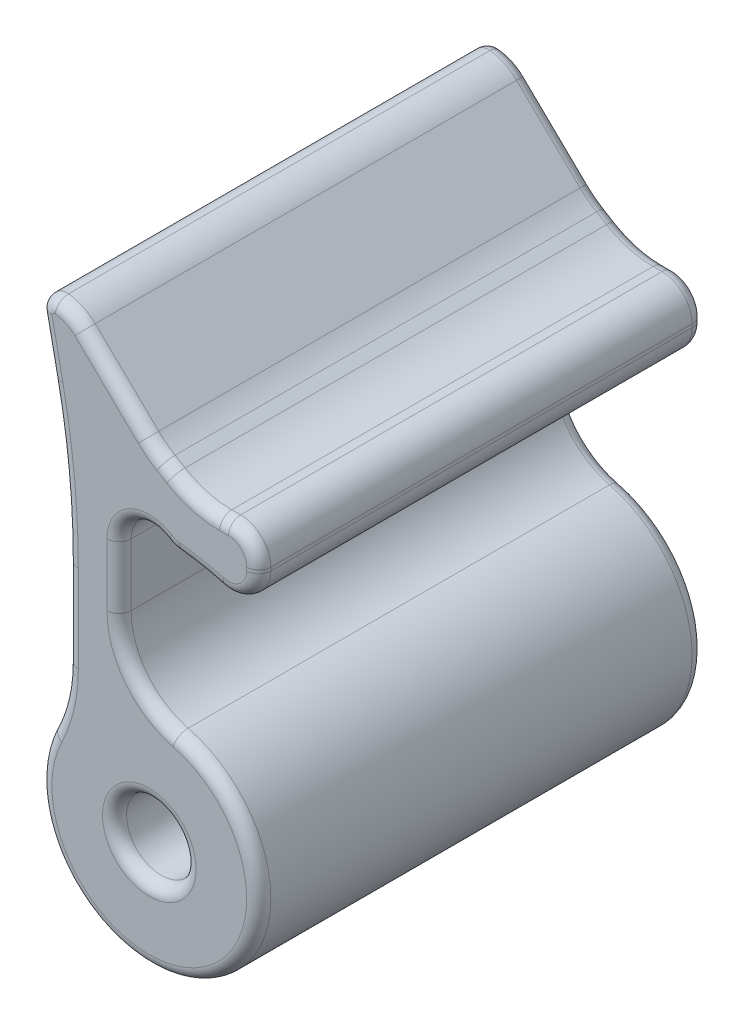
from build123d import *

# Parameters (mm, degrees)
SKETCH_1_R          = 2.3
EXTRUDE_1_DEPTH     = 29.5
CUT_EXTRUDE_2_DEPTH = 83.376773242
FILLET_4_R          = 3
FILLET_5_R          = 1
CUT_EXTRUDE_3_DEPTH = 83.368849205
CUT_EXTRUDE_4_DEPTH = 83.368849205
FILLET_6_R          = 2
FILLET_7_R          = 0.8


with BuildPart() as part:
    # 草图1 → 凸台-拉伸1 (new body)
    with BuildSketch(Plane.XY):
        with BuildLine():
            Line((49.84110478, 44.817097999), (48.055206395, 44.817097999))
            ThreePointArc((48.055206395, 44.817097999), (47.055206395, 45.085047192), (46.323155587, 45.817097999))
            ThreePointArc((46.323155587, 45.817097999), (44.073466689, 46.748949652), (42.59110478, 44.817097999))
            Line((42.59110478, 44.817097999), (42.59110478, 40.694071519))
            ThreePointArc((42.59110478, 40.694071519), (43.646332988, 37.621812495), (46.366614984, 35.846327225))
            ThreePointArc((46.366614984, 35.846327225), (49.045880364, 23.097178901), (37.34110478, 28.817097999))
            Line((37.34110478, 28.817097999), (37.34110478, 44.817097999))
            Line((37.34110478, 44.817097999), (37.34110478, 56.817097999))
            Line((37.34110478, 56.817097999), (42.59110478, 56.817097999))
            Line((42.59110478, 56.817097999), (42.59110478, 56.214240273))
            ThreePointArc((42.59110478, 56.214240273), (43.369905339, 53.258047383), (45.504130247, 51.069282719))
            Line((45.504130247, 51.069282719), (46.166034037, 50.672140445))
            ThreePointArc((46.166034037, 50.672140445), (47.651407078, 50.03480843), (49.253008569, 49.817097999))
            Line((49.253008569, 49.817097999), (49.84110478, 49.817097999))
            ThreePointArc((49.84110478, 49.817097999), (51.255318342, 49.231311562), (51.84110478, 47.817097999))
            Line((51.84110478, 47.817097999), (51.84110478, 46.817097999))
            ThreePointArc((51.84110478, 46.817097999), (51.255318342, 45.402884437), (49.84110478, 44.817097999))
        make_face()
        with Locations((44.59110478, 28.817097999)):
            Circle(SKETCH_1_R, mode=Mode.SUBTRACT)
    extrude(amount=EXTRUDE_1_DEPTH)

    # 草图3 → 切除-拉伸2 (cut, through all)
    with BuildSketch(Plane.XY.offset(29.5)):
        with BuildLine():
            Line((39.34110478, 56.817097999), (44.418230467, 51.902962044))
            ThreePointArc((44.418230467, 51.902962044), (43.066738487, 53.873006183), (42.59110478, 56.214240273))
            Line((42.59110478, 56.214240273), (42.59110478, 56.817097999))
            Line((42.59110478, 56.817097999), (39.34110478, 56.817097999))
        make_face()
    extrude(amount=-CUT_EXTRUDE_2_DEPTH, mode=Mode.SUBTRACT)

    # 圆角4
    fillet_4_edges = [part.edges().sort_by_distance(p)[0] for p in [
        (39.34110478, 56.817097999, 14.75),
    ]]
    fillet(fillet_4_edges, radius=FILLET_4_R)

    # 圆角5
    fillet_5_edges = [part.edges().sort_by_distance(p)[0] for p in [
        (37.34110478, 56.817097999, 14.75),
    ]]
    fillet(fillet_5_edges, radius=FILLET_5_R)

    # 草图4 → 切除-拉伸3 (cut, through all)
    with BuildSketch(Plane.XY.offset(29.5)):
        with BuildLine():
            Line((48.055206395, 44.817097999), (49.84110478, 44.817097999))
            ThreePointArc((49.84110478, 44.817097999), (50.40294591, 44.897635954), (50.919537504, 45.132763455))
            ThreePointArc((50.919537504, 45.132763455), (48.487682705, 45.877774436), (45.973519977, 46.262410499))
            ThreePointArc((45.973519977, 46.262410499), (46.164175162, 46.052188915), (46.323155587, 45.817097999))
            ThreePointArc((46.323155587, 45.817097999), (47.055206395, 45.085047192), (48.055206395, 44.817097999))
        make_face()
    extrude(amount=-CUT_EXTRUDE_3_DEPTH, mode=Mode.SUBTRACT)

    # 草图5 → 切除-拉伸4 (cut, through all)
    with BuildSketch(Plane.XY.offset(29.5)):
        with BuildLine():
            Line((39.09110478, 40.694071519), (39.09110478, 36.387599964))
            ThreePointArc((39.09110478, 36.387599964), (38.834181102, 34.135386882), (38.076612026, 31.998903173))
            ThreePointArc((38.076612026, 31.998903173), (37.527374446, 30.449952484), (37.34110478, 28.817097999))
            Line((37.34110478, 28.817097999), (37.34110478, 55.805608408))
            Line((37.34110478, 55.805608408), (38.08251228, 52.170475657))
            ThreePointArc((38.08251228, 52.170475657), (38.838317641, 47.199814526), (39.09110478, 42.178379225))
            Line((39.09110478, 42.178379225), (39.09110478, 40.694071519))
        make_face()
    extrude(amount=-CUT_EXTRUDE_4_DEPTH, mode=Mode.SUBTRACT)

    # 圆角6
    fillet_6_edges = [part.edges().sort_by_distance(p)[0] for p in [
        (45.973519977, 46.262410499, 14.75),
        (50.919537504, 45.132763455, 14.75),
    ]]
    fillet(fillet_6_edges, radius=FILLET_6_R)

    # 圆角7
    fillet_7_edges = [part.edges().sort_by_distance(p)[0] for p in [
        (38.834181102, 34.135386882, 0),
        (37.71180853, 53.988042032, 0),
        (38.838317641, 47.199814526, 0),
        (39.09110478, 39.282989595, 0),
        (38.834181102, 34.135386882, 29.5),
        (39.09110478, 39.282989595, 29.5),
        (38.838317641, 47.199814526, 29.5),
        (37.71180853, 53.988042032, 29.5),
        (47.91573673, 45.998390803, 29.5),
        (51.84110478, 47.707086018, 29.5),
        (51.050045829, 46.003819024, 29.5),
        (46.065724081, 46.311947, 29.5),
        (47.91573673, 45.998390803, 0),
        (51.84110478, 47.707086018, 0),
        (51.050045829, 46.003819024, 0),
        (46.065724081, 46.311947, 0),
        (43.625344619, 46.568470978, 0),
        (42.59110478, 42.755584759, 0),
        (43.646332988, 37.621812495, 0),
        (49.045880364, 23.097178901, 0),
        (44.937325008, 51.455049861, 0),
        (45.835082142, 50.870711582, 0),
        (47.651407078, 50.03480843, 0),
        (51.255318342, 49.231311562, 29.5),
        (49.547056674, 49.817097999, 0),
        (51.255318342, 49.231311562, 0),
        (49.547056674, 49.817097999, 29.5),
        (47.651407078, 50.03480843, 29.5),
        (45.835082142, 50.870711582, 29.5),
        (44.937325008, 51.455049861, 29.5),
        (42.29110478, 28.817097999, 0),
        (42.29110478, 28.817097999, 29.5),
        (49.045880364, 23.097178901, 29.5),
        (43.646332988, 37.621812495, 29.5),
        (42.59110478, 42.755584759, 29.5),
        (43.625344619, 46.568470978, 29.5),
        (42.315850747, 53.937849579, 29.5),
        (42.315850747, 53.937849579, 0),
        (39.399865757, 56.533694949, 29.5),
        (39.399865757, 56.533694949, 0),
        (37.67291149, 56.549596128, 0),
        (37.67291149, 56.549596128, 29.5),
    ]]
    fillet(fillet_7_edges, radius=FILLET_7_R)


solid = part.part
